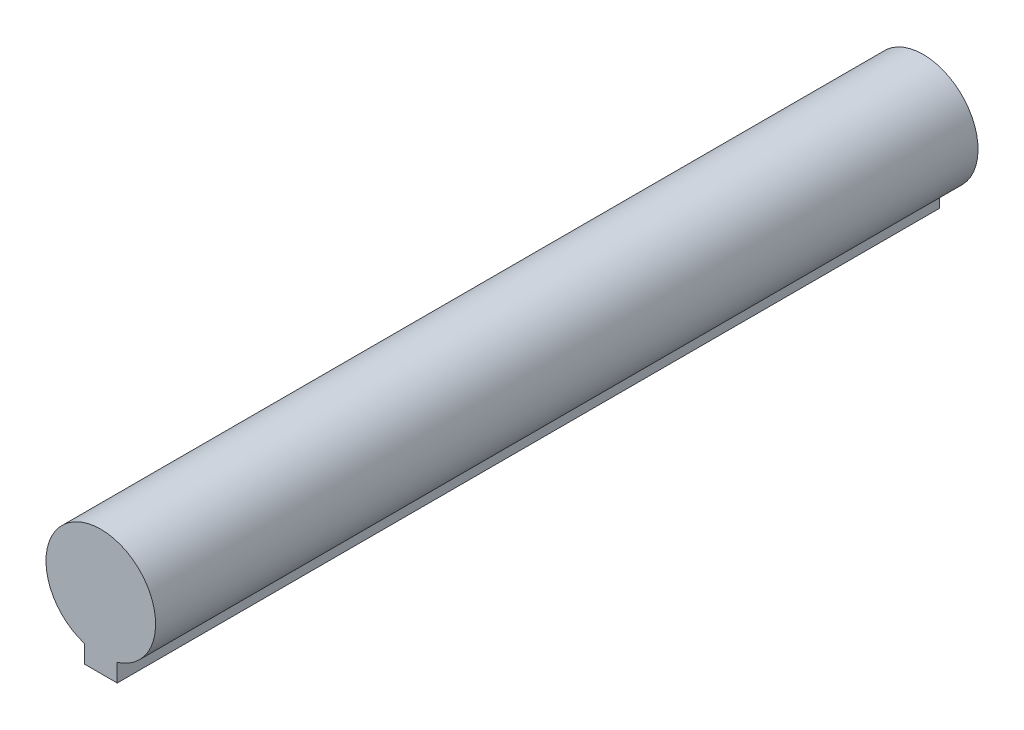
from build123d import *

# Parameters (mm, degrees)
BOSS_EXTRUDE1_DEPTH = 150


with BuildPart() as part:
    # Sketch1 → Boss-Extrude1 (new body)
    with BuildSketch(Plane.XY):
        with BuildLine():
            Line((-3, -12.799392014), (3, -12.799392014))
            Line((3, -12.799392014), (3, -9.539392014))
            ThreePointArc((3, -9.539392014), (0, 10), (-3, -9.539392014))
            Line((-3, -9.539392014), (-3, -12.799392014))
        make_face()
    extrude(amount=BOSS_EXTRUDE1_DEPTH)


solid = part.part
